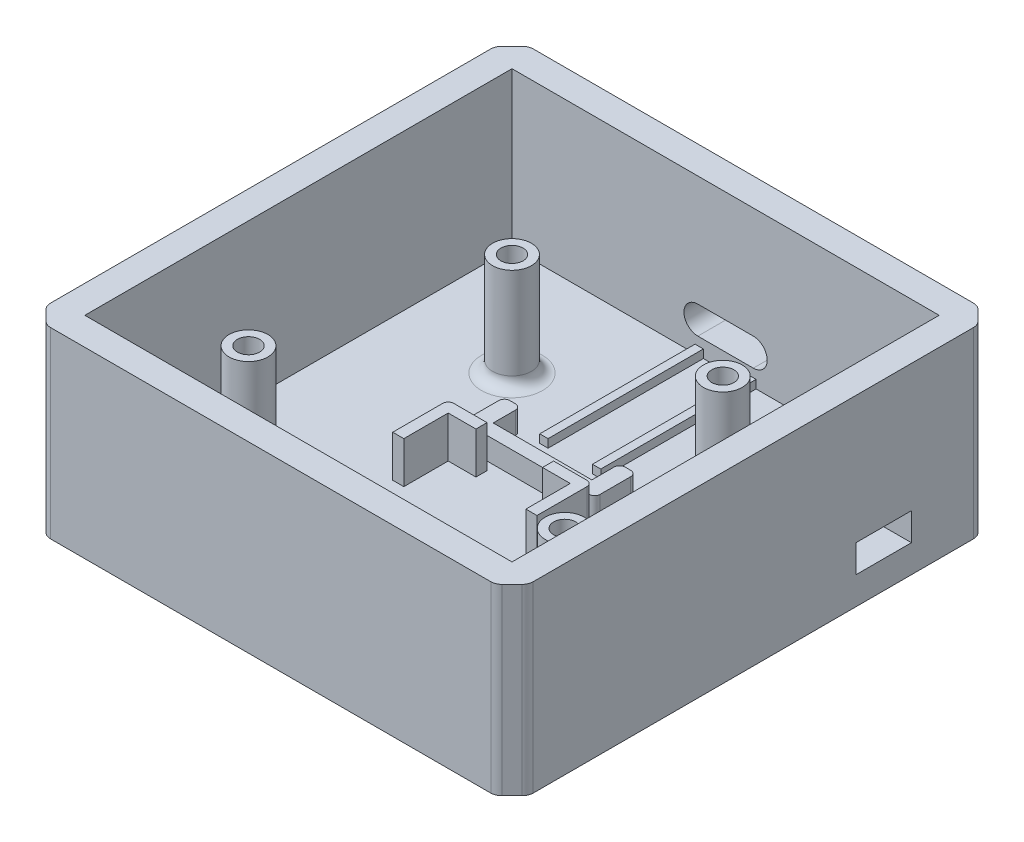
from build123d import *

# Parameters (mm, degrees)
SKETCH1_W           = 77
SKETCH1_H           = 77
BOSS_EXTRUDE1_DEPTH = 5
SKETCH2_W           = 87
SKETCH2_H           = 87
SKETCH2_W_2         = 77
SKETCH2_H_2         = 77
BOSS_EXTRUDE2_DEPTH = 33
SKETCH3_R           = 3.5
SKETCH3_R_2         = 2
BOSS_EXTRUDE4_DEPTH = 18.5
SKETCH11_W          = 1.5
SKETCH11_H          = 28
BOSS_EXTRUDE7_DEPTH = 1.5
BOSS_EXTRUDE8_DEPTH = 4
SKETCH7_R           = 4
CUT_EXTRUDE1_DEPTH  = 2
CUT_EXTRUDE2_DEPTH  = 5
SKETCH16_W          = 10
SKETCH16_H          = 5
CUT_EXTRUDE3_DEPTH  = 5
BOSS_EXTRUDE6_DEPTH = 7.5
FILLET1_R           = 2
FILLET2_R           = 1
CHAMFER1_SIZE       = 3
FILLET3_R           = 2


with BuildPart() as part:
    # Sketch1 → Boss-Extrude1 (new body)
    with BuildSketch(Plane(origin=(0, 0, 0), x_dir=(1, 0, 0), z_dir=(0, 1, 0))):
        Rectangle(SKETCH1_W, SKETCH1_H)
    extrude(amount=BOSS_EXTRUDE1_DEPTH)

    # Sketch2 → Boss-Extrude2 (add)
    with BuildSketch(Plane(origin=(0, 0, 0), x_dir=(1, 0, 0), z_dir=(0, 1, 0))):
        Rectangle(SKETCH2_W, SKETCH2_H)
        Rectangle(SKETCH2_W_2, SKETCH2_H_2, mode=Mode.SUBTRACT)
    extrude(amount=BOSS_EXTRUDE2_DEPTH)

    # Sketch3 → Boss-Extrude4 (add)
    # profile 1 of 4: a face of its own
    with BuildSketch(Plane(origin=(0, 5, 0), x_dir=(1, 0, 0), z_dir=(0, 1, 0))):
        with Locations(Location((-28.5, -19, 0), (0, 0, 90))):
            Circle(SKETCH3_R)
        with Locations(Location((-28.5, -19, 0), (0, 0, 270))):
            Circle(SKETCH3_R_2, mode=Mode.SUBTRACT)
    # profile 2 of 4: a face of its own
    with BuildSketch(Plane(origin=(0, 5, 0), x_dir=(1, 0, 0), z_dir=(0, 1, 0))):
        with Locations(Location((-19, 19, 0), (0, 0, 90))):
            Circle(SKETCH3_R)
        with Locations(Location((-19, 19, 0), (0, 0, 270))):
            Circle(SKETCH3_R_2, mode=Mode.SUBTRACT)
    # profile 3 of 4: a face of its own
    with BuildSketch(Plane(origin=(0, 5, 0), x_dir=(1, 0, 0), z_dir=(0, 1, 0))):
        with Locations(Location((28.5, -19, 0), (0, 0, 90))):
            Circle(SKETCH3_R)
        with Locations(Location((28.5, -19, 0), (0, 0, 270))):
            Circle(SKETCH3_R_2, mode=Mode.SUBTRACT)
    # profile 4 of 4: a face of its own
    with BuildSketch(Plane(origin=(0, 5, 0), x_dir=(1, 0, 0), z_dir=(0, 1, 0))):
        with Locations(Location((19, 19, 0), (0, 0, 90))):
            Circle(SKETCH3_R)
        with Locations(Location((19, 19, 0), (0, 0, 270))):
            Circle(SKETCH3_R_2, mode=Mode.SUBTRACT)
    extrude(amount=BOSS_EXTRUDE4_DEPTH)

    # Sketch11 → Boss-Extrude7 (add)
    with BuildSketch(Plane(origin=(0, 5, 0), x_dir=(1, 0, 0), z_dir=(0, 1, 0))):
        with Locations((4.75, 24.5)):
            Rectangle(SKETCH11_W, SKETCH11_H)
        with Locations((-4.75, 24.5)):
            Rectangle(SKETCH11_W, SKETCH11_H)
    extrude(amount=BOSS_EXTRUDE7_DEPTH)

    # Sketch17 → Boss-Extrude8 (add)
    with BuildSketch(Plane(origin=(0, 5, 0), x_dir=(1, 0, 0), z_dir=(0, 1, 0))):
        Polygon((-8.89, 10.5), (-8.89, 5.5), (8.89, 5.5), (8.89, 10.5), (11.89, 10.5), (11.89, 3), (-11.89, 3), (-11.89, 10.5), align=None)
    extrude(amount=BOSS_EXTRUDE8_DEPTH)

    # Sketch7 → Cut-Extrude1 (cut)
    with BuildSketch(Plane.XZ):
        with Locations(Location((-27.5, -27.5, 0), (0, 0, 270))):
            Circle(SKETCH7_R)
        with Locations(Location((-27.5, 27.5, 0), (0, 0, 270))):
            Circle(SKETCH7_R)
        with Locations(Location((27.5, 27.5, 0), (0, 0, 270))):
            Circle(SKETCH7_R)
        with Locations(Location((27.5, -27.5, 0), (0, 0, 270))):
            Circle(SKETCH7_R)
    extrude(amount=-CUT_EXTRUDE1_DEPTH, mode=Mode.SUBTRACT)

    # Sketch10 → Cut-Extrude2 (cut)
    with BuildSketch(Plane(origin=(0, 0, -38.5), x_dir=(-1, 0, 0), z_dir=(0, 0, -1))):
        with BuildLine():
            Line((-5, 13), (5, 13))
            ThreePointArc((5, 13), (7.5, 10.5), (5, 8))
            Line((5, 8), (-5, 8))
            ThreePointArc((-5, 8), (-7.5, 10.5), (-5, 13))
        make_face()
    extrude(amount=CUT_EXTRUDE2_DEPTH, mode=Mode.SUBTRACT)

    # Sketch16 → Cut-Extrude3 (cut)
    with BuildSketch(Plane.ZY.offset(-38.5)):
        with Locations((-23.5, 7.5)):
            Rectangle(SKETCH16_W, SKETCH16_H)
    extrude(amount=-CUT_EXTRUDE3_DEPTH, mode=Mode.SUBTRACT)

    # Sketch15 → Boss-Extrude6 (add)
    with BuildSketch(Plane(origin=(0, 5, 0), x_dir=(1, 0, 0), z_dir=(0, 1, 0))):
        Polygon((-11, -0.5), (-11, -8.5), (-13, -8.5), (-13, 1.5), (-6, 1.5), (-6, -0.5), align=None)
        Polygon((-13, -24.5), (-11, -24.5), (-11, -32.5), (-6, -32.5), (-6, -34.5), (-13, -34.5), align=None)
        Polygon((13, -24.5), (11, -24.5), (11, -32.5), (6, -32.5), (6, -34.5), (13, -34.5), align=None)
        Polygon((6, 1.5), (6, -0.5), (11, -0.5), (11, -8.5), (13, -8.5), (13, 1.5), align=None)
    extrude(amount=BOSS_EXTRUDE6_DEPTH)

    # Fillet1
    fillet1_edges = [part.edges().sort_by_distance(p)[0] for p in [
        (28.5, 5, 22.5),
        (19, 5, -15.5),
        (-28.5, 5, 22.5),
        (-19, 5, -15.5),
    ]]
    fillet(fillet1_edges, radius=FILLET1_R)

    # Fillet2
    fillet2_edges = [part.edges().sort_by_distance(p)[0] for p in [
        (-8.89, 7, -10.5),
        (-11.89, 7, -10.5),
        (-11.89, 7, -3),
        (11.89, 7, -3),
        (11.89, 7, -10.5),
        (8.89, 7, -10.5),
        (-13, 8.75, -1.5),
        (13, 8.75, -1.5),
        (-13, 8.75, 34.5),
        (13, 8.75, 34.5),
    ]]
    fillet(fillet2_edges, radius=FILLET2_R)

    # Chamfer1
    chamfer1_edges = [part.edges().sort_by_distance(p)[0] for p in [
        (-43.5, 16.5, 43.5),
        (43.5, 16.5, 43.5),
        (43.5, 16.5, -43.5),
        (-43.5, 16.5, -43.5),
    ]]
    chamfer(chamfer1_edges, length=CHAMFER1_SIZE)

    # Fillet3
    fillet3_edges = [part.edges().sort_by_distance(p)[0] for p in [
        (-40.5, 16.5, -43.5),
        (40.5, 16.5, -43.5),
        (43.5, 16.5, 40.5),
        (43.5, 16.5, -40.5),
        (40.5, 16.5, 43.5),
        (-40.5, 16.5, 43.5),
        (-43.5, 16.5, -40.5),
        (-43.5, 16.5, 40.5),
    ]]
    fillet(fillet3_edges, radius=FILLET3_R)


solid = part.part
